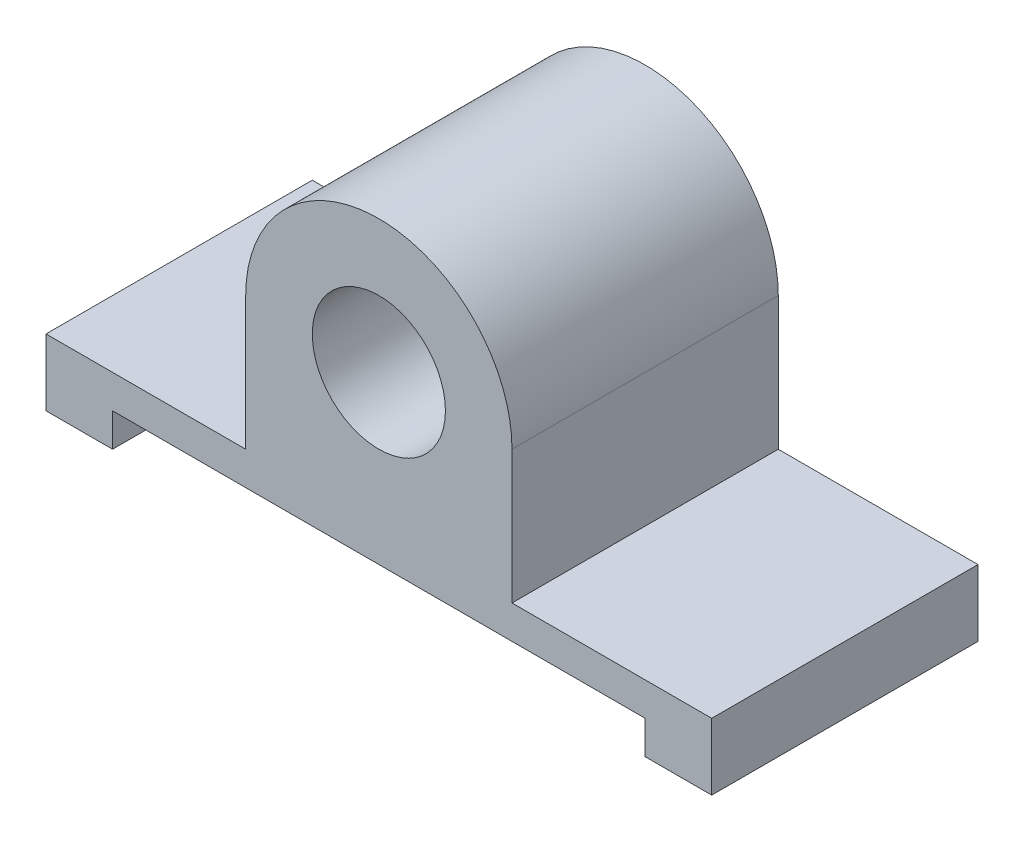
from build123d import *

# Parameters (mm, degrees)
SKETCH1_R           = 10
BOSS_EXTRUDE1_DEPTH = 20


with BuildPart() as part:
    # Sketch1 → Boss-Extrude1 (new, symmetric)
    with BuildSketch(Plane.XY):
        with BuildLine():
            Line((50, 0), (50, 10))
            Line((50, 10), (20, 10))
            Line((20, 10), (20, 30))
            ThreePointArc((20, 30), (0, 50), (-20, 30))
            Line((-20, 30), (-20, 10))
            Line((-20, 10), (-50, 10))
            Line((-50, 10), (-50, 0))
            Line((-50, 0), (-40, 0))
            Line((-40, 0), (-40, 5))
            Line((-40, 5), (40, 5))
            Line((40, 5), (40, 0))
            Line((40, 0), (50, 0))
        make_face()
        with Locations((0, 30)):
            Circle(SKETCH1_R, mode=Mode.SUBTRACT)
    extrude(amount=BOSS_EXTRUDE1_DEPTH, both=True)


solid = part.part
